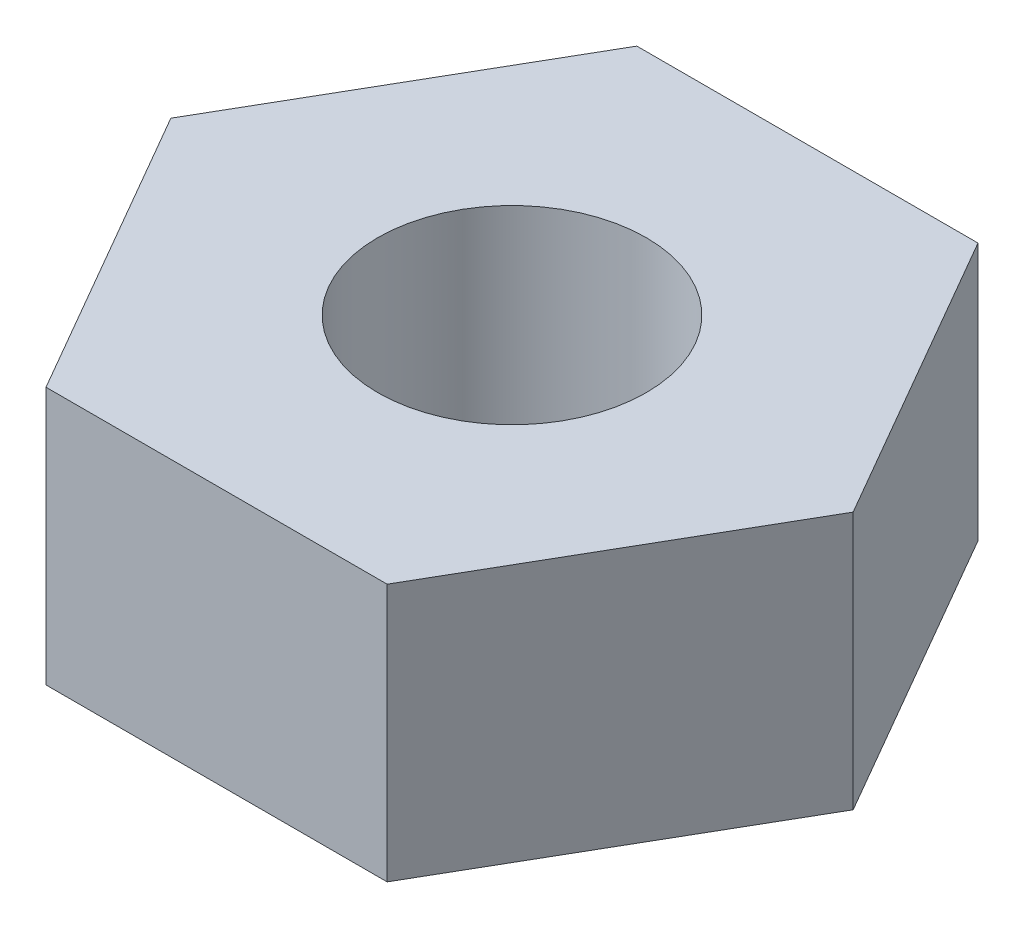
from build123d import *

# Parameters (mm, degrees)
CROQUIS1_R              = 1.25
SALIENTE_EXTRUIR1_DEPTH = 2.4


with BuildPart() as part:
    # Croquis1 → Saliente-Extruir1 (new body)
    with BuildSketch(Plane(origin=(0, 0, 0), x_dir=(1, 0, 0), z_dir=(0, 1, 0))):
        Polygon((-1.58771324, 2.75), (-3.175426481, 0), (-1.58771324, -2.75), (1.58771324, -2.75), (3.175426481, 0), (1.58771324, 2.75), align=None)
        with Locations(Location((0, 0, 0), (0, 0, 270))):
            Circle(CROQUIS1_R, mode=Mode.SUBTRACT)
    extrude(amount=SALIENTE_EXTRUIR1_DEPTH)


solid = part.part
